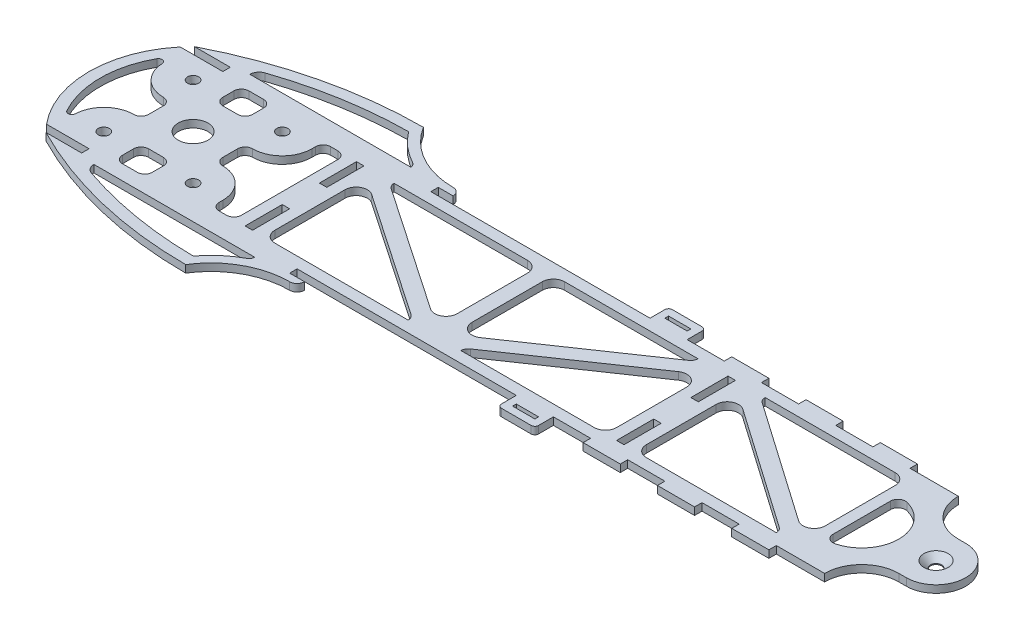
from build123d import *

# Parameters (mm, degrees)
SKETCH1_R           = 4
SKETCH1_R_2         = 1.5
SKETCH1_W           = 2
SKETCH1_H           = 10
SKETCH1_W_2         = 6
SKETCH1_H_2         = 1
BOSS_EXTRUDE1_DEPTH = 2
CHAMFER1_SIZE       = 1.75


with BuildPart() as part:
    # Sketch1 → Boss-Extrude1 (new body)
    with BuildSketch(Plane(origin=(0, 0, 0), x_dir=(1, 0, 0), z_dir=(0, 1, 0))):
        with BuildLine():
            Line((-19.595917942, 20), (-10, 20))
            Line((-10, 20), (-10, 18))
            Line((-10, 18), (-21.44761059, 18))
            ThreePointArc((-21.44761059, 18), (-28, 0), (-21.44761059, -18))
            Line((-21.44761059, -18), (-10, -18))
            Line((-10, -18), (-10, -20))
            Line((-10, -20), (-19.595917942, -20))
            ThreePointArc((-19.595917942, -20), (4.486498297, -28.957333217), (30, -32))
            ThreePointArc((30, -32), (37.704369859, -24.667865746), (48, -22))
            ThreePointArc((48, -22), (49.414213562, -21.414213562), (50, -20))
            Line((50, -20), (46, -20))
            Line((46, -20), (46, -18))
            Line((46, -18), (105, -18))
            Line((105, -18), (105, -22))
            ThreePointArc((105, -22), (105.292893219, -22.707106781), (106, -23))
            Line((106, -23), (114, -23))
            ThreePointArc((114, -23), (114.707106781, -22.707106781), (115, -22))
            Line((115, -22), (115, -18))
            Line((115, -18), (125, -18))
            Line((125, -18), (125, -20))
            Line((125, -20), (135, -20))
            Line((135, -20), (135, -18))
            Line((135, -18), (145, -18))
            Line((145, -18), (145, -20))
            Line((145, -20), (155, -20))
            Line((155, -20), (155, -18))
            Line((155, -18), (165, -18))
            Line((165, -18), (165, -20))
            Line((165, -20), (175, -20))
            Line((175, -20), (175, -18))
            Line((175, -18), (188, -18))
            ThreePointArc((188, -18), (190.928932188, -10.928932188), (198, -8))
            Line((198, -8), (200, -8))
            ThreePointArc((200, -8), (208, 0), (200, 8))
            Line((200, 8), (198, 8))
            ThreePointArc((198, 8), (190.928932188, 10.928932188), (188, 18))
            Line((188, 18), (175, 18))
            Line((175, 18), (175, 20))
            Line((175, 20), (165, 20))
            Line((165, 20), (165, 18))
            Line((165, 18), (155, 18))
            Line((155, 18), (155, 20))
            Line((155, 20), (145, 20))
            Line((145, 20), (145, 18))
            Line((145, 18), (135, 18))
            Line((135, 18), (135, 20))
            Line((135, 20), (125, 20))
            Line((125, 20), (125, 18))
            Line((125, 18), (115, 18))
            Line((115, 18), (115, 22))
            ThreePointArc((115, 22), (114.707106781, 22.707106781), (114, 23))
            Line((114, 23), (106, 23))
            ThreePointArc((106, 23), (105.292893219, 22.707106781), (105, 22))
            Line((105, 22), (105, 18))
            Line((105, 18), (46, 18))
            Line((46, 18), (46, 20))
            Line((46, 20), (50, 20))
            ThreePointArc((50, 20), (49.414213562, 21.414213562), (48, 22))
            ThreePointArc((48, 22), (37.704369859, 24.667865746), (30, 32))
            ThreePointArc((30, 32), (4.486498297, 28.957333217), (-19.595917942, 20))
        make_face()
        with Locations(Location((0, 0, 0), (0, 0, 270))):
            Circle(SKETCH1_R, mode=Mode.SUBTRACT)
        with Locations(Location((12.02081528, 12.02081528, 0), (0, 0, 270))):
            Circle(SKETCH1_R_2, mode=Mode.SUBTRACT)
        with Locations(Location((12.02081528, -12.02081528, 0), (0, 0, 270))):
            Circle(SKETCH1_R_2, mode=Mode.SUBTRACT)
        with Locations(Location((200, 0, 0), (0, 0, 270))):
            Circle(SKETCH1_R_2, mode=Mode.SUBTRACT)
        with Locations(Location((-12.02081528, -12.02081528, 0), (0, 0, 270))):
            Circle(SKETCH1_R_2, mode=Mode.SUBTRACT)
        with Locations(Location((-12.02081528, 12.02081528, 0), (0, 0, 270))):
            Circle(SKETCH1_R_2, mode=Mode.SUBTRACT)
        with BuildLine():
            Line((20, 12), (20, 13))
            ThreePointArc((20, 13), (20.585786438, 14.414213562), (22, 15))
            Line((22, 15), (24, 15))
            ThreePointArc((24, 15), (25.414213562, 14.414213562), (26, 13))
            Line((26, 13), (26, -13))
            ThreePointArc((26, -13), (25.414213562, -14.414213562), (24, -15))
            Line((24, -15), (22, -15))
            ThreePointArc((22, -15), (20.585786438, -14.414213562), (20, -13))
            Line((20, -13), (20, -12))
            ThreePointArc((20, -12), (17.656854249, -6.343145751), (12, -4))
            ThreePointArc((12, -4), (10.585786438, -3.414213562), (10, -2))
            Line((10, -2), (10, 2))
            ThreePointArc((10, 2), (10.585786438, 3.414213562), (12, 4))
            ThreePointArc((12, 4), (17.656854249, 6.343145751), (20, 12))
        make_face(mode=Mode.SUBTRACT)
        with BuildLine():
            Line((-10, 2), (-10, -2))
            ThreePointArc((-10, -2), (-10.585786438, -3.414213562), (-12, -4))
            ThreePointArc((-12, -4), (-17.540158364, -6.228809022), (-19.993327991, -11.673338675))
            ThreePointArc((-19.993327991, -11.673338675), (-20.762004134, -12.605580738), (-21.86718124, -12.11719376))
            ThreePointArc((-21.86718124, -12.11719376), (-25, 0), (-21.86718124, 12.11719376))
            ThreePointArc((-21.86718124, 12.11719376), (-20.762004134, 12.605580738), (-19.993327991, 11.673338675))
            ThreePointArc((-19.993327991, 11.673338675), (-17.540158364, 6.228809022), (-12, 4))
            ThreePointArc((-12, 4), (-10.585786438, 3.414213562), (-10, 2))
        make_face(mode=Mode.SUBTRACT)
        with BuildLine():
            Line((-4, 15), (-4, 12))
            ThreePointArc((-4, 12), (-3.414213562, 10.585786438), (-2, 10))
            Line((-2, 10), (2, 10))
            ThreePointArc((2, 10), (3.414213562, 10.585786438), (4, 12))
            Line((4, 12), (4, 15))
            ThreePointArc((4, 15), (3.414213562, 16.414213562), (2, 17))
            Line((2, 17), (-2, 17))
            ThreePointArc((-2, 17), (-3.414213562, 16.414213562), (-4, 15))
        make_face(mode=Mode.SUBTRACT)
        with BuildLine():
            Line((-5.705989571, 21), (37.575235851, 21))
            ThreePointArc((37.575235851, 21), (37.362619066, 21.769834046), (36.785043241, 22.321428571))
            ThreePointArc((36.785043241, 22.321428571), (32.542204025, 25.234851974), (29.02836603, 28.995525195))
            ThreePointArc((29.02836603, 28.995525195), (12.283175601, 27.501603596), (-4.012040055, 23.366491626))
            ThreePointArc((-4.012040055, 23.366491626), (-5.238860227, 22.455141538), (-5.705989571, 21))
        make_face(mode=Mode.SUBTRACT)
        with Locations((30, 10)):
            Rectangle(SKETCH1_W, SKETCH1_H, mode=Mode.SUBTRACT)
        with Locations((110, 20.5)):
            Rectangle(SKETCH1_W_2, SKETCH1_H_2, mode=Mode.SUBTRACT)
        with BuildLine():
            Line((180, 7.745966692), (180, -7.745966692))
            ThreePointArc((180, -7.745966692), (180.775255129, -9.327105522), (182.5, -9.682458366))
            ThreePointArc((182.5, -9.682458366), (190, 0), (182.5, 9.682458366))
            ThreePointArc((182.5, 9.682458366), (180.775255129, 9.327105522), (180, 7.745966692))
        make_face(mode=Mode.SUBTRACT)
        with Locations((110, -20.5)):
            Rectangle(SKETCH1_W_2, SKETCH1_H_2, mode=Mode.SUBTRACT)
        with Locations((30, -10)):
            Rectangle(SKETCH1_W, SKETCH1_H, mode=Mode.SUBTRACT)
        with BuildLine():
            Line((-5.705989571, -21), (37.575235851, -21))
            ThreePointArc((37.575235851, -21), (37.362619066, -21.769834046), (36.785043241, -22.321428571))
            ThreePointArc((36.785043241, -22.321428571), (32.542204025, -25.234851974), (29.02836603, -28.995525195))
            ThreePointArc((29.02836603, -28.995525195), (12.283175601, -27.501603596), (-4.012040055, -23.366491626))
            ThreePointArc((-4.012040055, -23.366491626), (-5.238860227, -22.455141538), (-5.705989571, -21))
        make_face(mode=Mode.SUBTRACT)
        with BuildLine():
            Line((-2, -17), (2, -17))
            ThreePointArc((2, -17), (3.414213562, -16.414213562), (4, -15))
            Line((4, -15), (4, -12))
            ThreePointArc((4, -12), (3.414213562, -10.585786438), (2, -10))
            Line((2, -10), (-2, -10))
            ThreePointArc((-2, -10), (-3.414213562, -10.585786438), (-4, -12))
            Line((-4, -12), (-4, -15))
            ThreePointArc((-4, -15), (-3.414213562, -16.414213562), (-2, -17))
        make_face(mode=Mode.SUBTRACT)
        with BuildLine():
            Line((139.846424397, 13.359746091), (172.283455212, -9.270740524))
            ThreePointArc((172.283455212, -9.270740524), (175.387509574, -9.470212511), (177, -6.810359661))
            Line((177, -6.810359661), (177, 12))
            ThreePointArc((177, 12), (176.121320344, 14.121320344), (174, 15))
            Line((174, 15), (138.990787589, 15))
            ThreePointArc((138.990787589, 15), (139.217552356, 14.074993617), (139.846424397, 13.359746091))
        make_face(mode=Mode.SUBTRACT)
        with BuildLine():
            Line((39.10054771, 15), (75, 15))
            ThreePointArc((75, 15), (77.121320344, 14.121320344), (78, 12))
            Line((78, 12), (78, -6.902942293))
            ThreePointArc((78, -6.902942293), (76.401778973, -9.555302697), (73.309989526, -9.381624321))
            Line((73.309989526, -9.381624321), (39.97387406, 13.347545314))
            ThreePointArc((39.97387406, 13.347545314), (39.332307441, 14.065480685), (39.10054771, 15))
        make_face(mode=Mode.SUBTRACT)
        with BuildLine():
            Line((34, 6.902942293), (34, -12))
            ThreePointArc((34, -12), (34.878679656, -14.121320344), (37, -15))
            Line((37, -15), (72.89945229, -15))
            ThreePointArc((72.89945229, -15), (72.667692559, -14.065480685), (72.02612594, -13.347545314))
            Line((72.02612594, -13.347545314), (38.690010474, 9.381624321))
            ThreePointArc((38.690010474, 9.381624321), (35.598221027, 9.555302697), (34, 6.902942293))
        make_face(mode=Mode.SUBTRACT)
        with BuildLine():
            Line((85, 15), (120.89945229, 15))
            ThreePointArc((120.89945229, 15), (120.667692559, 14.065480685), (120.02612594, 13.347545314))
            Line((120.02612594, 13.347545314), (86.690010474, -9.381624321))
            ThreePointArc((86.690010474, -9.381624321), (83.598221027, -9.555302697), (82, -6.902942293))
            Line((82, -6.902942293), (82, 12))
            ThreePointArc((82, 12), (82.878679656, 14.121320344), (85, 15))
        make_face(mode=Mode.SUBTRACT)
        with BuildLine():
            Line((126, 6.902942293), (126, -12))
            ThreePointArc((126, -12), (125.121320344, -14.121320344), (123, -15))
            Line((123, -15), (87.10054771, -15))
            ThreePointArc((87.10054771, -15), (87.332307441, -14.065480685), (87.97387406, -13.347545314))
            Line((87.97387406, -13.347545314), (121.309989526, 9.381624321))
            ThreePointArc((121.309989526, 9.381624321), (124.401778973, 9.555302697), (126, 6.902942293))
        make_face(mode=Mode.SUBTRACT)
        with Locations((130, 10)):
            Rectangle(SKETCH1_W, SKETCH1_H, mode=Mode.SUBTRACT)
        with Locations((130, -10)):
            Rectangle(SKETCH1_W, SKETCH1_H, mode=Mode.SUBTRACT)
        with BuildLine():
            Line((134, 6.810359661), (134, -12))
            ThreePointArc((134, -12), (134.878679656, -14.121320344), (137, -15))
            Line((137, -15), (172.009212411, -15))
            ThreePointArc((172.009212411, -15), (171.782447644, -14.074993617), (171.153575603, -13.359746091))
            Line((171.153575603, -13.359746091), (138.716544788, 9.270740524))
            ThreePointArc((138.716544788, 9.270740524), (135.612490426, 9.470212511), (134, 6.810359661))
        make_face(mode=Mode.SUBTRACT)
    extrude(amount=BOSS_EXTRUDE1_DEPTH)

    # Chamfer1
    chamfer1_edges = [part.edges().sort_by_distance(p)[0] for p in [
        (200, 2, -1.5),
    ]]
    chamfer(chamfer1_edges, length=CHAMFER1_SIZE)


solid = part.part
